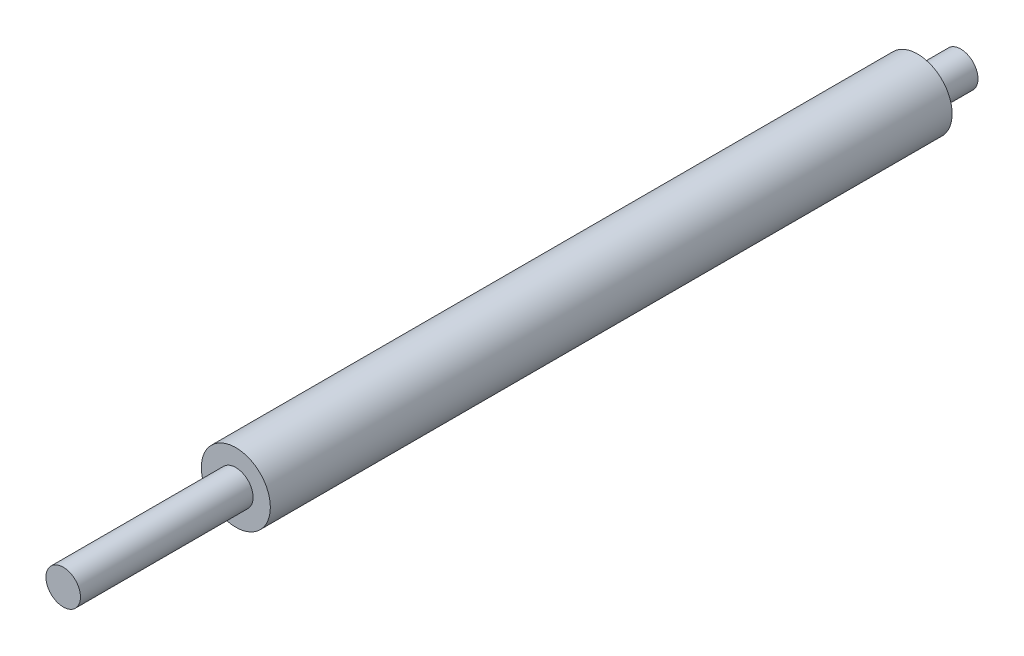
from build123d import *

# Parameters (mm, degrees)
SKETCH1_R           = 6
BOSS_EXTRUDE1_DEPTH = 59.25
SKETCH3_R           = 3
BOSS_EXTRUDE3_DEPTH = 7.5
BOSS_EXTRUDE4_START = 30
SKETCH2_R           = 3
BOSS_EXTRUDE4_DEPTH = 30


with BuildPart() as part:
    # Sketch1 → Boss-Extrude1 (new, symmetric)
    with BuildSketch(Plane.XY):
        Circle(SKETCH1_R)
    extrude(amount=BOSS_EXTRUDE1_DEPTH, both=True)

    # Sketch3 → Boss-Extrude3 (add)
    with BuildSketch(Plane(origin=(0, 0, -59.25), x_dir=(-1, 0, 0), z_dir=(0, 0, -1))):
        with Locations(Location((0, 0, 0), (0, 0, 180))):
            Circle(SKETCH3_R)
    extrude(amount=BOSS_EXTRUDE3_DEPTH)

    # Sketch2 → Boss-Extrude4 (add)
    with BuildSketch(Plane.XY.offset(59.25).offset(BOSS_EXTRUDE4_START)):
        Circle(SKETCH2_R)
    extrude(amount=-BOSS_EXTRUDE4_DEPTH)


solid = part.part
